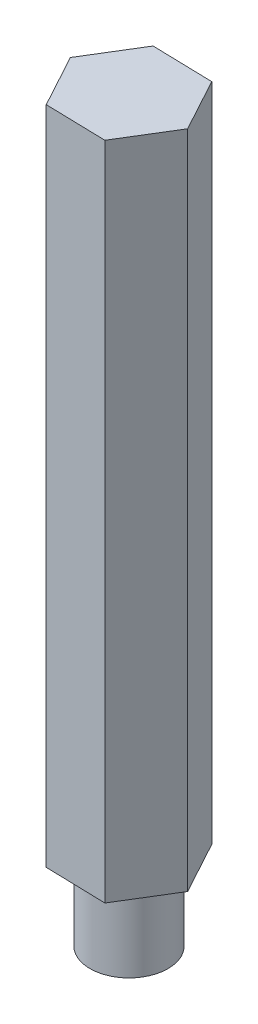
from build123d import *

# Parameters (mm, degrees)
SALIENTE_EXTRUIR1_DEPTH = 90
CROQUIS2_OUTSIDE_W      = 35.078
CROQUIS2_OUTSIDE_H      = 33.302
CROQUIS2_OUTSIDE_R      = 4.75
CORTAR_EXTRUIR1_DEPTH   = 9.525


with BuildPart() as part:
    # Croquis1 → Saliente-Extruir1 (new body)
    with BuildSketch(Plane(origin=(0, 0, 0), x_dir=(1, 0, 0), z_dir=(0, 1, 0))):
        Polygon((3.502287207, -6.44184117), (7.329941703, -0.187850892), (3.827654496, 6.253990277), (-3.502287207, 6.44184117), (-7.329941703, 0.187850892), (-3.827654496, -6.253990277), align=None)
    extrude(amount=SALIENTE_EXTRUIR1_DEPTH)

    # Croquis2 outside → Cortar-Extruir1 (cut)
    with BuildSketch(Plane.XZ):
        Rectangle(CROQUIS2_OUTSIDE_W, CROQUIS2_OUTSIDE_H)
        with Locations(Location((0, 0, 0), (0, 0, 270))):
            Circle(CROQUIS2_OUTSIDE_R, mode=Mode.SUBTRACT)
    extrude(amount=-CORTAR_EXTRUIR1_DEPTH, mode=Mode.SUBTRACT)


solid = part.part
